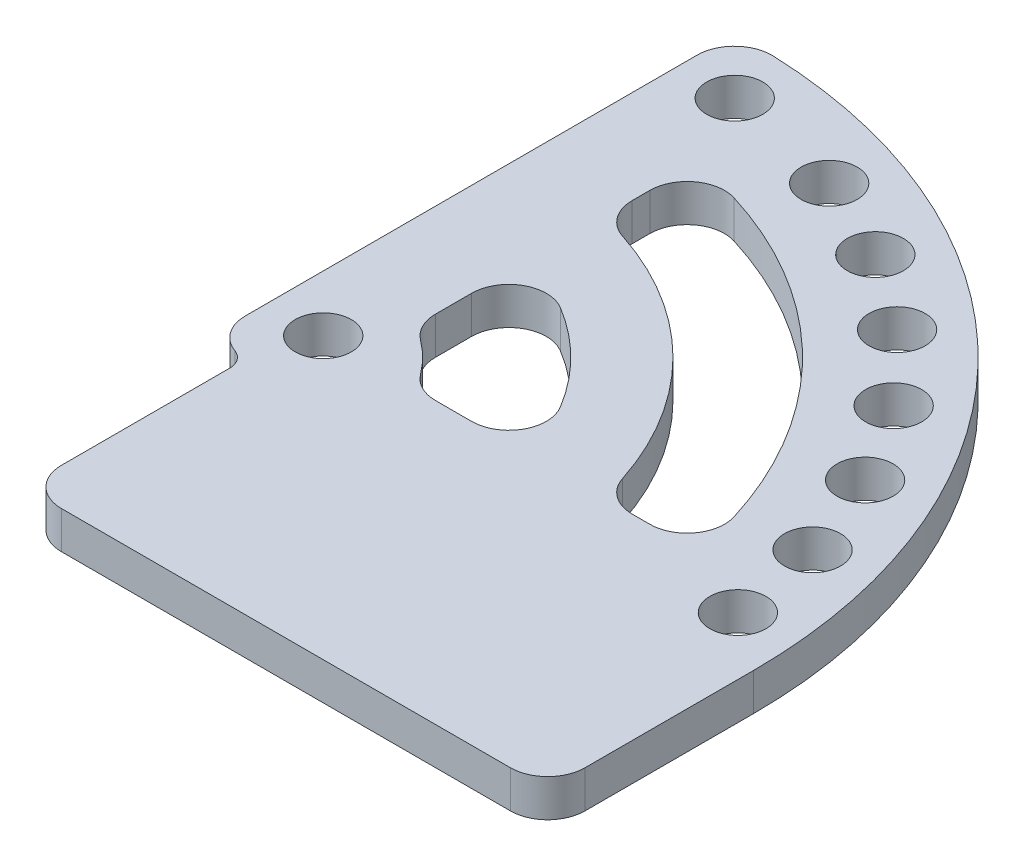
from build123d import *

# Parameters (mm, degrees)
SKETCH_1_R      = 1.5
EXTRUDE_1_DEPTH = 2
FILLET_1_R      = 2


with BuildPart() as part:
    # 草图1 → 凸台-拉伸1 (new body)
    with BuildSketch(Plane(origin=(0, 0, 0), x_dir=(1, 0, 0), z_dir=(0, 1, 0))):
        with BuildLine():
            Line((-11, 0), (0, 0))
            Line((0, 0), (11, 0))
            Line((11, 0), (14, 0))
            Line((14, 0), (14, 11))
            ThreePointArc((14, 11), (5.506096654, 31.506096654), (-15, 40))
            Line((-15, 40), (-16, 40))
            Line((-16, 40), (-16, 12))
            Line((-16, 12), (-15, 12))
            ThreePointArc((-15, 12), (-14.292893219, 11.707106781), (-14, 11))
            Line((-14, 11), (-14, 0))
            Line((-14, 0), (-11, 0))
        make_face()
        with Locations(Location((10.90106215, 13.266049311, 0), (0, 0, 270))):
            Circle(SKETCH_1_R, mode=Mode.SUBTRACT)
        with Locations(Location((9.992804094, 18.166571251, 0), (0, 0, 270))):
            Circle(SKETCH_1_R, mode=Mode.SUBTRACT)
        with Locations(Location((8.166169629, 22.803752993, 0), (0, 0, 270))):
            Circle(SKETCH_1_R, mode=Mode.SUBTRACT)
        with Locations(Location((5.488279594, 27.007198358, 0), (0, 0, 270))):
            Circle(SKETCH_1_R, mode=Mode.SUBTRACT)
        with Locations(Location((2.057534754, 30.622449086, 0), (0, 0, 270))):
            Circle(SKETCH_1_R, mode=Mode.SUBTRACT)
        with Locations(Location((-2, 33.516660498, 0), (0, 0, 270))):
            Circle(SKETCH_1_R, mode=Mode.SUBTRACT)
        with Locations(Location((-6.535227984, 35.583482966, 0), (0, 0, 270))):
            Circle(SKETCH_1_R, mode=Mode.SUBTRACT)
        with Locations(Location((-13, 15, 0), (0, 0, 270))):
            Circle(SKETCH_1_R, mode=Mode.SUBTRACT)
        with Locations(Location((-13, 37, 0), (0, 0, 270))):
            Circle(SKETCH_1_R, mode=Mode.SUBTRACT)
        with BuildLine():
            Line((-11, 24), (-11, 17.92820323))
            ThreePointArc((-11, 17.92820323), (-9.343145751, 16.656854249), (-8.07179677, 15))
            Line((-8.07179677, 15), (-2, 15))
            ThreePointArc((-2, 15), (-5.382307969, 20.617692031), (-11, 24))
        make_face(mode=Mode.SUBTRACT)
        with BuildLine():
            Line((-11, 28), (-11, 33))
            ThreePointArc((-11, 33), (0.811388301, 26.811388301), (7, 15))
            Line((7, 15), (2, 15))
            ThreePointArc((2, 15), (-2.650910965, 23.349089035), (-11, 28))
        make_face(mode=Mode.SUBTRACT)
    extrude(amount=EXTRUDE_1_DEPTH)

    # 圆角1
    fillet_1_edges = [part.edges().sort_by_distance(p)[0] for p in [
        (-14, 1, 0),
        (-16, 1, -12),
        (-16, 1, -40),
        (14, 1, 0),
        (-11, 1, -17.92820323),
        (-8.07179677, 1, -15),
        (-2, 1, -15),
        (-11, 1, -24),
        (7, 1, -15),
        (-11, 1, -28),
        (2, 1, -15),
        (-11, 1, -33),
    ]]
    fillet(fillet_1_edges, radius=FILLET_1_R)


solid = part.part
